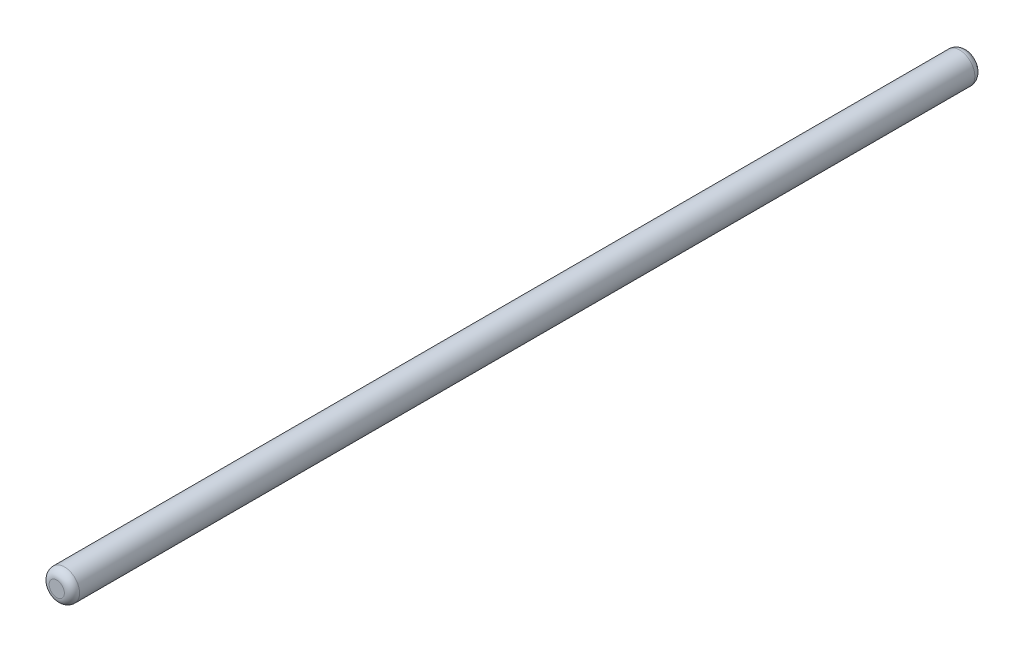
from build123d import *

# Parameters (mm, degrees)
SKETCH1_R           = 4
BOSS_EXTRUDE1_DEPTH = 239
FILLET1_R           = 2


with BuildPart() as part:
    # Sketch1 → Boss-Extrude1 (new body)
    with BuildSketch(Plane.XY):
        Circle(SKETCH1_R)
    extrude(amount=BOSS_EXTRUDE1_DEPTH)

    # Fillet1
    fillet1_edges = [part.edges().sort_by_distance(p)[0] for p in [
        (-4, 0, 0),
        (-4, 0, 239),
    ]]
    fillet(fillet1_edges, radius=FILLET1_R)


solid = part.part
